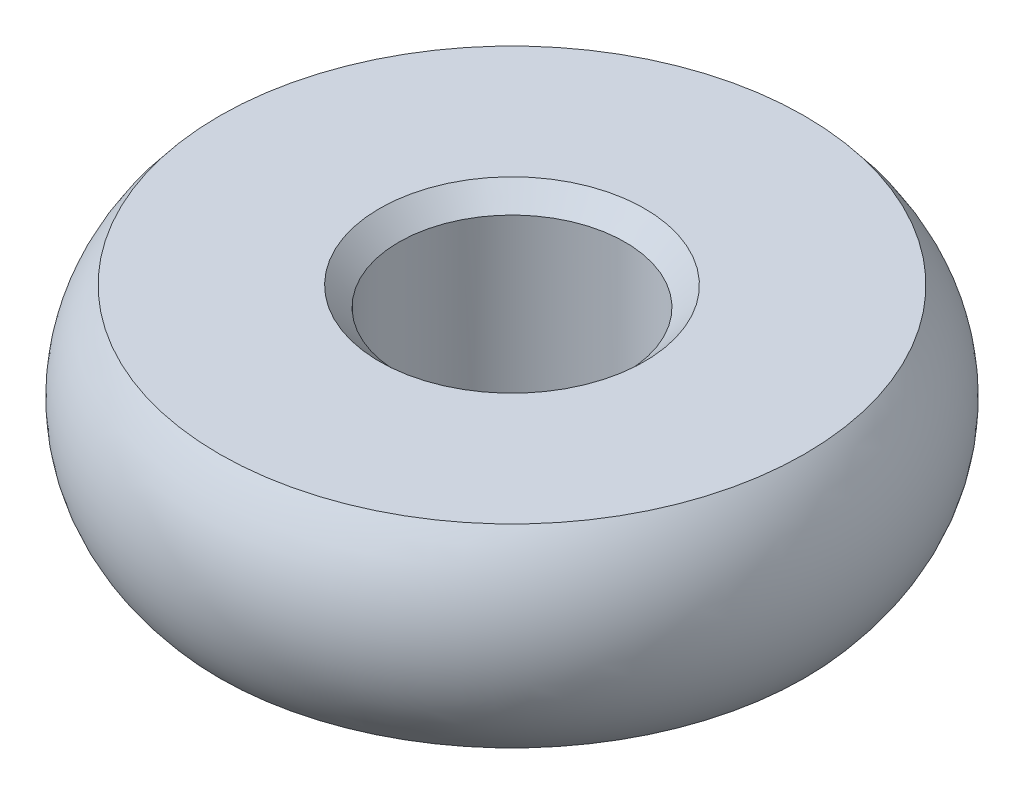
from build123d import *

# Parameters (mm, degrees)
CHAMFER1_SIZE = 3


with BuildPart() as part:
    # Sketch1 → Revolve1 (revolve)
    with BuildSketch(Plane.XY):
        with BuildLine():
            Line((17.5, 15), (17.5, -15))
            Line((17.5, -15), (45.270509831, -15))
            ThreePointArc((45.270509831, -15), (51, 0), (45.270509831, 15))
            Line((45.270509831, 15), (17.5, 15))
        make_face()
    revolve(axis=Axis((0, -562.822725834, 0), (0, 1, 0)))

    # Chamfer1
    chamfer1_edges = [part.edges().sort_by_distance(p)[0] for p in [
        (-17.5, 15, 0),
        (-17.5, -15, 0),
    ]]
    chamfer(chamfer1_edges, length=CHAMFER1_SIZE)


solid = part.part
